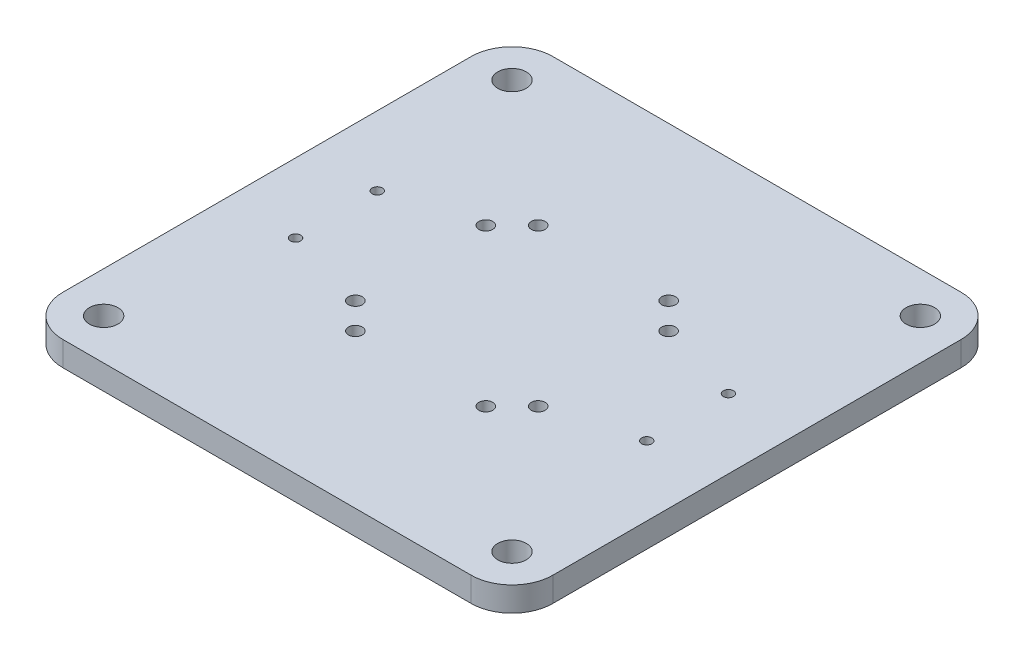
from build123d import *

# Parameters (mm, degrees)
SKETCH_1_W                   = 120
SKETCH_1_H                   = 120
EXTRUDE_1_DEPTH              = 6
SKETCH_2_R                   = 3.5
CUT_EXTRUDE_1_DEPTH          = 10
FILLET_1_R                   = 10
HOLE_WIZARD_M3_1_D           = 3.4
HOLE_WIZARD_M3_1_CSINK_D     = 6.6
HOLE_WIZARD_M3_1_CSINK_ANGLE = 90
HOLE_WIZARD_M3_1_2_D         = 2.5
HOLE_WIZARD_M3_1_2_DEPTH     = 6
HOLE_WIZARD_M3_1_2_TIP       = 0.751075774


with BuildPart() as part:
    # 草图1 → 凸台-拉伸1 (new body)
    with BuildSketch(Plane(origin=(0, 0, 0), x_dir=(1, 0, 0), z_dir=(0, 1, 0))):
        Rectangle(SKETCH_1_W, SKETCH_1_H)
    extrude(amount=EXTRUDE_1_DEPTH)

    # 草图2 → 切除-拉伸1 (cut)
    with BuildSketch(Plane(origin=(0, 6, 0), x_dir=(1, 0, 0), z_dir=(0, 1, 0))):
        with Locations(Location((-50, 50, 0), (0, 0, 270))):
            Circle(SKETCH_2_R)
        with Locations(Location((50, 50, 0), (0, 0, 270))):
            Circle(SKETCH_2_R)
        with Locations(Location((50, -50, 0), (0, 0, 270))):
            Circle(SKETCH_2_R)
        with Locations(Location((-50, -50, 0), (0, 0, 270))):
            Circle(SKETCH_2_R)
    extrude(amount=-CUT_EXTRUDE_1_DEPTH, mode=Mode.SUBTRACT)

    # 圆角1
    fillet_1_edges = [part.edges().sort_by_distance(p)[0] for p in [
        (60, 3, 60),
        (-60, 3, 60),
        (-60, 3, -60),
        (60, 3, -60),
    ]]
    fillet(fillet_1_edges, radius=FILLET_1_R)

    # Hole Wizard M3 _1 (through all)
    with Locations(Plane.XZ):
        with Locations((15.969331282, -22.388176755), (22.388176755, -15.969331282), (22.388176755, 15.969331282), (15.969331282, 22.388176755), (-15.969331282, 22.388176755), (-22.388176755, 15.969331282), (-22.388176755, -15.969331282), (-15.969331282, -22.388176755)):
            CounterSinkHole(HOLE_WIZARD_M3_1_D / 2, HOLE_WIZARD_M3_1_CSINK_D / 2, counter_sink_angle=HOLE_WIZARD_M3_1_CSINK_ANGLE)

    # Hole Wizard M3 _1 2
    with Locations(Plane(origin=(0, 6, 0), x_dir=(1, 0, 0), z_dir=(0, 1, 0))):
        with Locations((-43, -10), (-43, 10), (43, -10), (43, 10)):
            Hole(HOLE_WIZARD_M3_1_2_D / 2, depth=HOLE_WIZARD_M3_1_2_DEPTH)
            with Locations((0, 0, -(HOLE_WIZARD_M3_1_2_DEPTH + HOLE_WIZARD_M3_1_2_TIP / 2))):  # 118° drill point
                Cone(0, HOLE_WIZARD_M3_1_2_D / 2, HOLE_WIZARD_M3_1_2_TIP, mode=Mode.SUBTRACT)


solid = part.part
